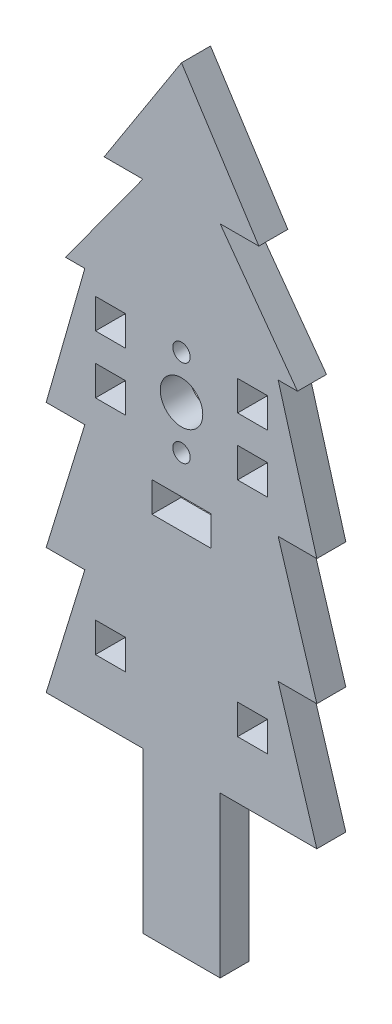
from build123d import *

# Parameters (mm, degrees)
PROFILE_LASER_PROFILE_3MM_R   = 2.2
PROFILE_LASER_PROFILE_3MM_R_2 = 0.9
PROFILE_LASER_PROFILE_3MM_W   = 3.1
PROFILE_LASER_PROFILE_3MM_H   = 3.1
PROFILE_LASER_PROFILE_3MM_W_2 = 6.1
LASER_PROFILE_3MM_DEPTH       = 3


with BuildPart() as part:
    # Profile_Laser_profile_3mm → Laser_profile_3mm (new body)
    with BuildSketch(Plane.XY):
        Polygon((0, 30.427227289), (8, 18), (4, 18), (12, 7), (10, 7), (14, -7), (10, -7), (14, -20), (10, -20), (14, -33), (4, -33), (4, -49.572772711), (-4, -49.572772711), (-4, -33), (-14, -33), (-10, -20), (-14, -20), (-10, -7), (-14, -7), (-10, 7), (-12, 7), (-4, 18), (-8, 18), align=None)
        Circle(PROFILE_LASER_PROFILE_3MM_R, mode=Mode.SUBTRACT)
        with Locations((0, -4.5)):
            Circle(PROFILE_LASER_PROFILE_3MM_R_2, mode=Mode.SUBTRACT)
        with Locations((0, 4.5)):
            Circle(PROFILE_LASER_PROFILE_3MM_R_2, mode=Mode.SUBTRACT)
        with Locations((-7.35, 3.5)):
            Rectangle(PROFILE_LASER_PROFILE_3MM_W, PROFILE_LASER_PROFILE_3MM_H, mode=Mode.SUBTRACT)
        with Locations((-7.35, -2.5)):
            Rectangle(PROFILE_LASER_PROFILE_3MM_W, PROFILE_LASER_PROFILE_3MM_H, mode=Mode.SUBTRACT)
        with Locations((-7.35, -25.5)):
            Rectangle(PROFILE_LASER_PROFILE_3MM_W, PROFILE_LASER_PROFILE_3MM_H, mode=Mode.SUBTRACT)
        with Locations((7.35, 3.5)):
            Rectangle(PROFILE_LASER_PROFILE_3MM_W, PROFILE_LASER_PROFILE_3MM_H, mode=Mode.SUBTRACT)
        with Locations((7.35, -2.5)):
            Rectangle(PROFILE_LASER_PROFILE_3MM_W, PROFILE_LASER_PROFILE_3MM_H, mode=Mode.SUBTRACT)
        with Locations((7.35, -25.5)):
            Rectangle(PROFILE_LASER_PROFILE_3MM_W, PROFILE_LASER_PROFILE_3MM_H, mode=Mode.SUBTRACT)
        with Locations((0, -10)):
            Rectangle(PROFILE_LASER_PROFILE_3MM_W_2, PROFILE_LASER_PROFILE_3MM_H, mode=Mode.SUBTRACT)
    extrude(amount=LASER_PROFILE_3MM_DEPTH)


solid = part.part
